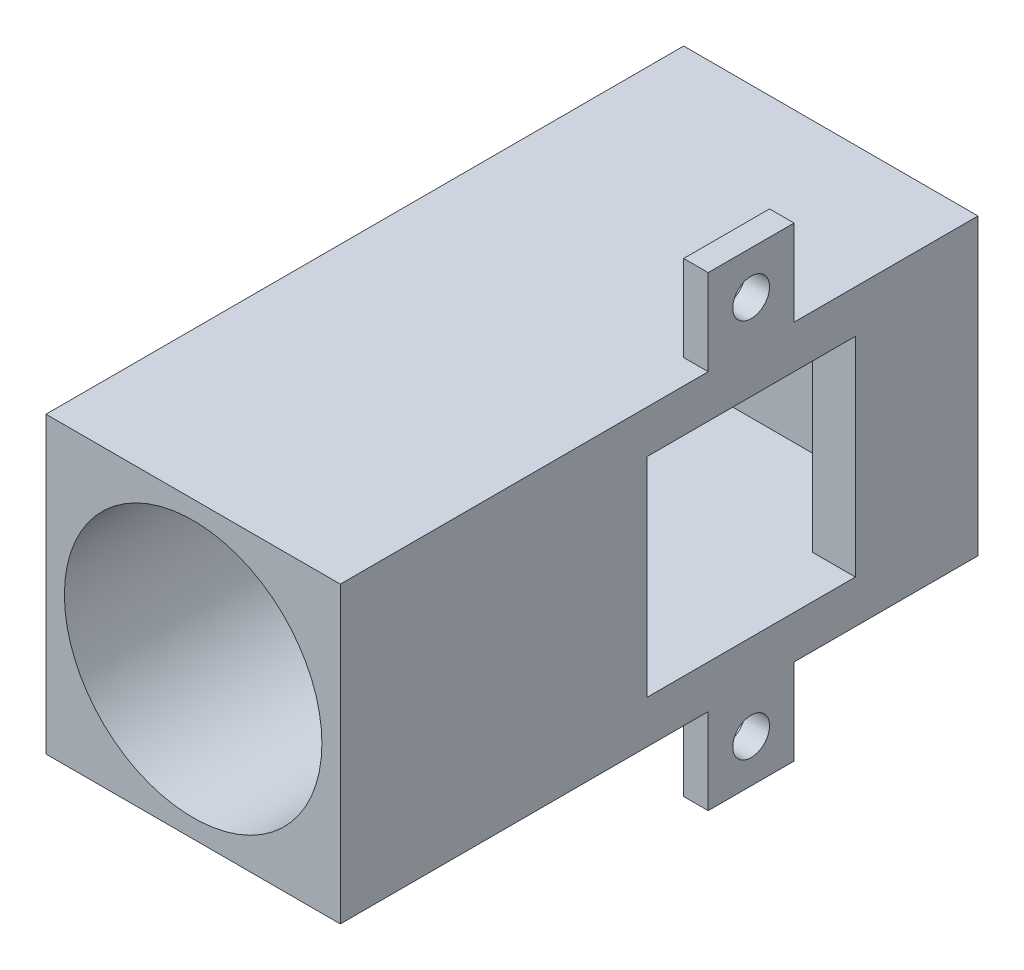
from build123d import *

# Parameters (mm, degrees)
EXTRUDE_1_DEPTH      = 42
EXTRUDE_1_DEPTH_BACK = 10
SKETCH_1_W           = 24
SKETCH_1_H           = 24
SKETCH_3_R           = 10.5
CUT_EXTRUDE_1_DEPTH  = 20
SKETCH_4_W           = 17
SKETCH_4_H           = 17
CUT_EXTRUDE_2_DEPTH  = 29
SKETCH_5_W           = 17
SKETCH_5_H           = 17
CUT_EXTRUDE_5_DEPTH  = 50.839743178
SKETCH_6_W           = 7
SKETCH_6_H           = 7
SKETCH_6_R           = 1.5
EXTRUDE_2_DEPTH      = 2


with BuildPart() as part:
    # Эскиз1 → Бобышка-Вытянуть1 (new, two sides: drawn at the far end of the back side and taken through both)
    with BuildSketch(Plane.XY.offset(-EXTRUDE_1_DEPTH_BACK)):
        Rectangle(SKETCH_1_W, SKETCH_1_H)
    extrude(amount=EXTRUDE_1_DEPTH + EXTRUDE_1_DEPTH_BACK)

    # Эскиз3 → Вырез-Вытянуть1 (cut)
    with BuildSketch(Plane.XY.offset(42)):
        Circle(SKETCH_3_R)
    extrude(amount=-CUT_EXTRUDE_1_DEPTH, mode=Mode.SUBTRACT)

    # Эскиз4 → Вырез-Вытянуть2 (cut)
    with BuildSketch(Plane.XY.offset(22)):
        Rectangle(SKETCH_4_W, SKETCH_4_H)
    extrude(amount=-CUT_EXTRUDE_2_DEPTH, mode=Mode.SUBTRACT)

    # Эскиз5 → Вырез-Вытянуть5 (cut, through all)
    with BuildSketch(Plane(origin=(12, 0, 0), x_dir=(0, 0, -1), z_dir=(1, 0, 0))):
        with Locations((-8.5, 0)):
            Rectangle(SKETCH_5_W, SKETCH_5_H)
    extrude(amount=-CUT_EXTRUDE_5_DEPTH, mode=Mode.SUBTRACT)

    # Эскиз6 → Бобышка-Вытянуть2 (add)
    # profile 1 of 2: a face of its own
    with BuildSketch(Plane(origin=(12, 0, 0), x_dir=(0, 0, -1), z_dir=(1, 0, 0))):
        with Locations((-8.5, 15.5)):
            Rectangle(SKETCH_6_W, SKETCH_6_H)
        with Locations((-8.5, 15.5)):
            Circle(SKETCH_6_R, mode=Mode.SUBTRACT)
    # profile 2 of 2: a face of its own
    with BuildSketch(Plane(origin=(12, 0, 0), x_dir=(0, 0, -1), z_dir=(1, 0, 0))):
        with Locations((-8.5, -15.5)):
            Rectangle(SKETCH_6_W, SKETCH_6_H)
        with Locations((-8.5, -15.5)):
            Circle(SKETCH_6_R, mode=Mode.SUBTRACT)
    extrude(amount=-EXTRUDE_2_DEPTH)


solid = part.part
